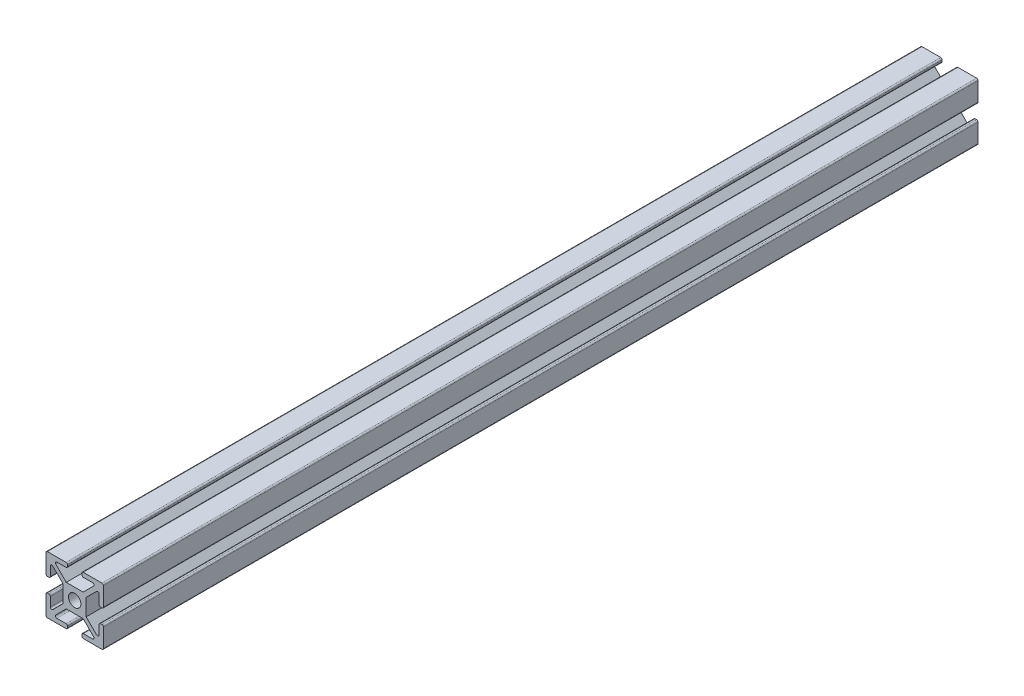
from build123d import *

# Parameters (mm, degrees)
SKETCH1_R           = 2.15
BOSS_EXTRUDE1_DEPTH = 304.8
FILLET1_R           = 0.5


with BuildPart() as part:
    # Sketch1 → Boss-Extrude1 (new body)
    with BuildSketch(Plane.XY):
        Polygon((-10, 2.5), (-8.5, 2.5), (-8.5, 7.439339828), (-4, 2.939339828), (-4, 0), (-4, -2.939339828), (-8.5, -7.439339828), (-8.5, -2.5), (-10, -2.5), (-10, -10), (-2.5, -10), (-2.5, -8.5), (-7.439339828, -8.5), (-2.939339828, -4), (0, -4), (2.939339828, -4), (7.439339828, -8.5), (2.5, -8.5), (2.5, -10), (10, -10), (10, -2.5), (8.5, -2.5), (8.5, -7.439339828), (4, -2.939339828), (4, 0), (4, 2.939339828), (8.5, 7.439339828), (8.5, 2.5), (10, 2.5), (10, 10), (2.5, 10), (2.5, 8.5), (7.439339828, 8.5), (2.939339828, 4), (0, 4), (-2.939339828, 4), (-7.439339828, 8.5), (-2.5, 8.5), (-2.5, 10), (-10, 10), align=None)
        with Locations(Location((0, 0, 0), (0, 0, 180))):
            Circle(SKETCH1_R, mode=Mode.SUBTRACT)
    extrude(amount=BOSS_EXTRUDE1_DEPTH)

    # Fillet1
    fillet1_edges = [part.edges().sort_by_distance(p)[0] for p in [
        (7.439339828, 8.5, 152.4),
        (2.5, 8.5, 152.4),
        (2.5, 10, 152.4),
        (10, 10, 152.4),
        (10, 2.5, 152.4),
        (8.5, 2.5, 152.4),
        (8.5, 7.439339828, 152.4),
        (8.5, -7.439339828, 152.4),
        (8.5, -2.5, 152.4),
        (10, -2.5, 152.4),
        (10, -10, 152.4),
        (2.5, -10, 152.4),
        (2.5, -8.5, 152.4),
        (7.439339828, -8.5, 152.4),
        (-7.439339828, -8.5, 152.4),
        (-2.5, -8.5, 152.4),
        (-2.5, -10, 152.4),
        (-10, -10, 152.4),
        (-10, -2.5, 152.4),
        (-8.5, -2.5, 152.4),
        (-8.5, -7.439339828, 152.4),
        (-8.5, 7.439339828, 152.4),
        (-8.5, 2.5, 152.4),
        (-10, 2.5, 152.4),
        (-10, 10, 152.4),
        (-2.5, 10, 152.4),
        (-2.5, 8.5, 152.4),
        (-7.439339828, 8.5, 152.4),
    ]]
    fillet(fillet1_edges, radius=FILLET1_R)


solid = part.part
